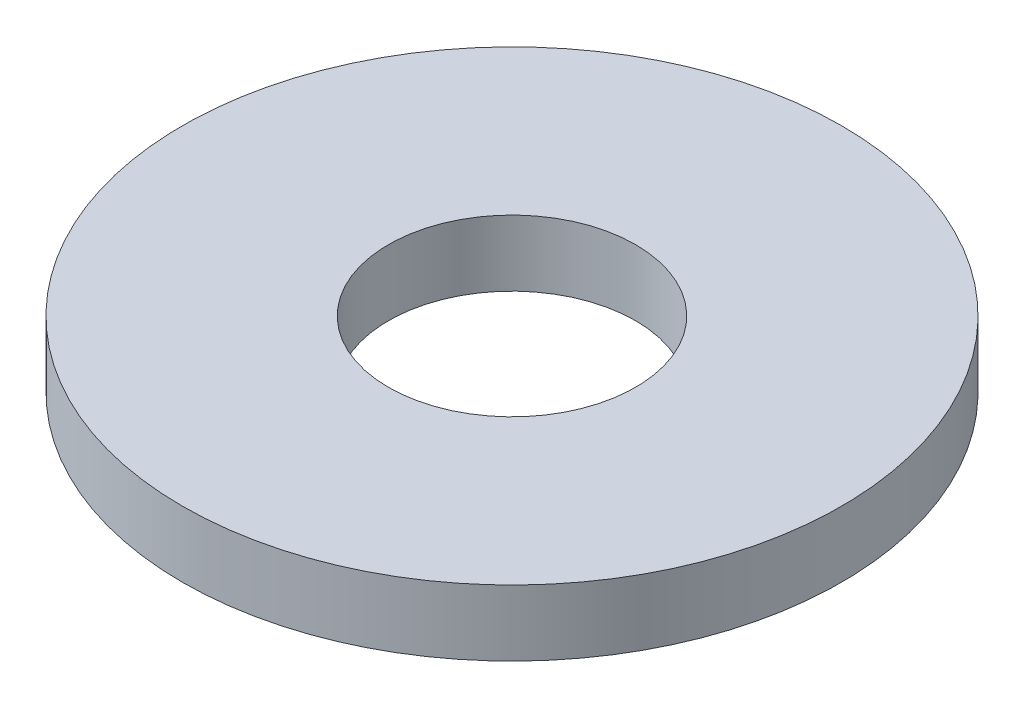
from build123d import *

# Parameters (mm, degrees)
SKETCH1_R           = 25.4
BOSS_EXTRUDE1_DEPTH = 5.08
SKETCH2_R           = 9.525
CUT_EXTRUDE1_DEPTH  = 5.08


with BuildPart() as part:
    # Sketch1 → Boss-Extrude1 (new body)
    with BuildSketch(Plane(origin=(0, 0, 0), x_dir=(1, 0, 0), z_dir=(0, 1, 0))):
        with Locations(Location((0, 0, 0), (0, 0, 270))):
            Circle(SKETCH1_R)
    extrude(amount=BOSS_EXTRUDE1_DEPTH)

    # Sketch2 → Cut-Extrude1 (cut)
    with BuildSketch(Plane(origin=(0, 5.08, 0), x_dir=(1, 0, 0), z_dir=(0, 1, 0))):
        with Locations(Location((0, 0, 0), (0, 0, 270))):
            Circle(SKETCH2_R)
    extrude(amount=-CUT_EXTRUDE1_DEPTH, mode=Mode.SUBTRACT)


solid = part.part
